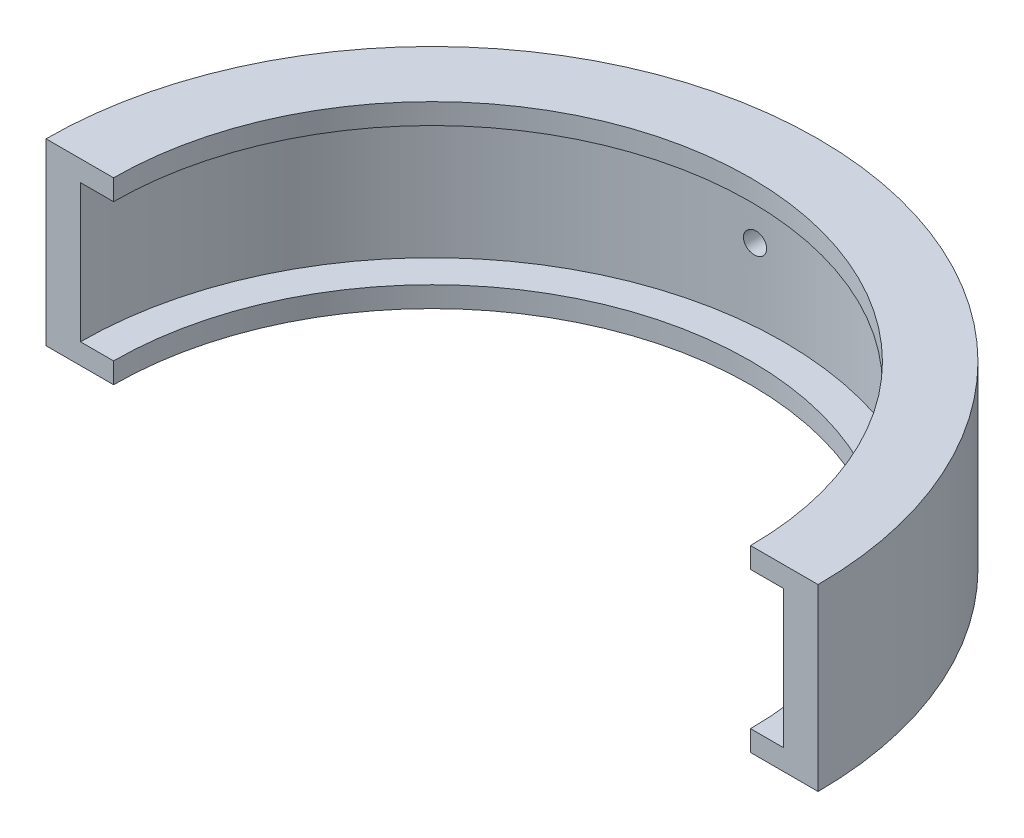
from build123d import *

# Parameters (mm, degrees)
REVOLVE1_ANGLE     = 180
SKETCH2_R          = 1.5
CUT_EXTRUDE1_DEPTH = 21


with BuildPart() as part:
    # Sketch1 → Revolve1 (revolve)
    with BuildSketch(Plane.XY):
        Polygon((-4.971917279, -11.985029192), (4.445516801, -11.985029192), (4.445516801, -9.102141208), (-0.167103973, -9.102141208), (-0.167103973, 10.117112016), (4.445516801, 10.117112016), (4.445516801, 13), (-4.971917279, 13), align=None)
    revolve(axis=Axis((48.841991749, -11.985029192, 0), (0, -1, 0)), revolution_arc=REVOLVE1_ANGLE)

    # Sketch2 → Cut-Extrude1 (cut)
    with BuildSketch(Plane.XY.offset(-54)):
        with Locations(Location((45.028082721, 1, 0), (0, 0, 180))):
            Circle(SKETCH2_R)
    extrude(amount=CUT_EXTRUDE1_DEPTH, mode=Mode.SUBTRACT)


solid = part.part
